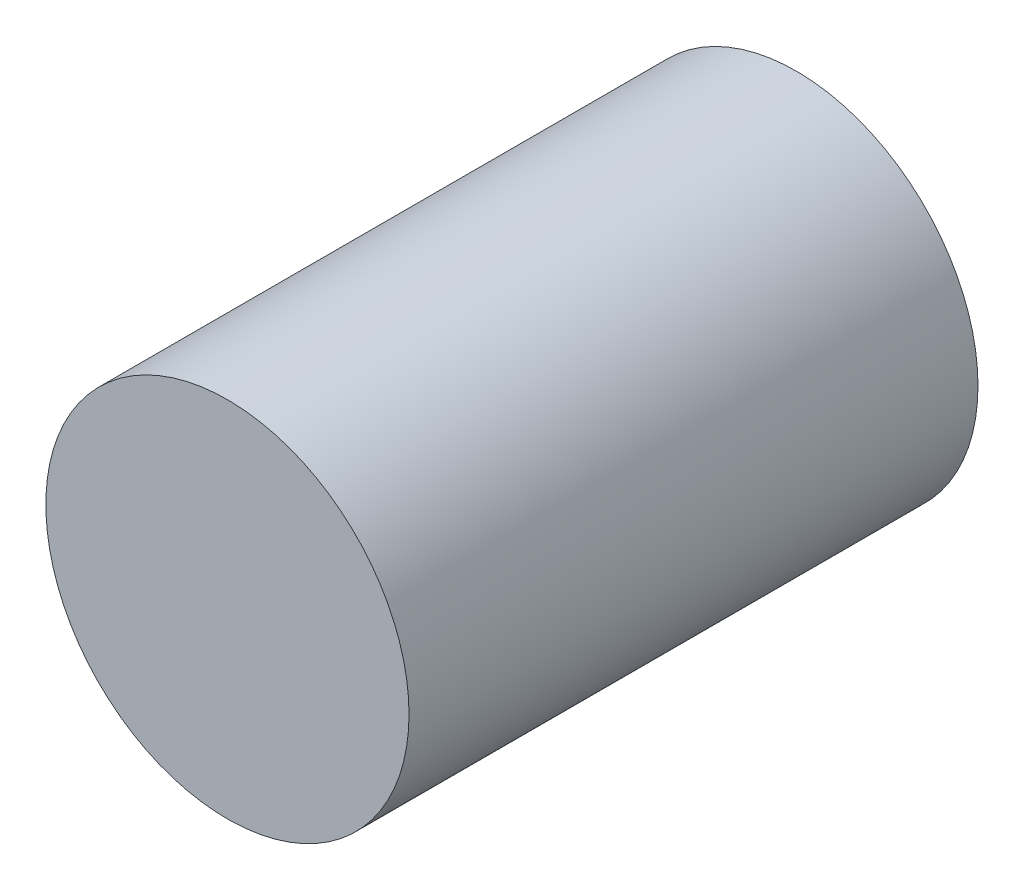
from build123d import *

# Parameters (mm, degrees)
SKETCH1_R           = 15
BOSS_EXTRUDE1_DEPTH = 23.5
SKETCH2_R           = 1.65
CUT_EXTRUDE1_DEPTH  = 10


with BuildPart() as part:
    # Sketch1 → Boss-Extrude1 (new, symmetric)
    with BuildSketch(Plane.XY):
        Circle(SKETCH1_R)
    extrude(amount=BOSS_EXTRUDE1_DEPTH, both=True)

    # Sketch2 → Cut-Extrude1 (cut)
    with BuildSketch(Plane(origin=(0, 0, -23.5), x_dir=(-1, 0, 0), z_dir=(0, 0, -1))):
        with Locations((8, 8)):
            Circle(SKETCH2_R)
        with Locations((8, -8)):
            Circle(SKETCH2_R)
        with Locations((-8, -8)):
            Circle(SKETCH2_R)
        with Locations((-8, 8)):
            Circle(SKETCH2_R)
    extrude(amount=-CUT_EXTRUDE1_DEPTH, mode=Mode.SUBTRACT)


solid = part.part
